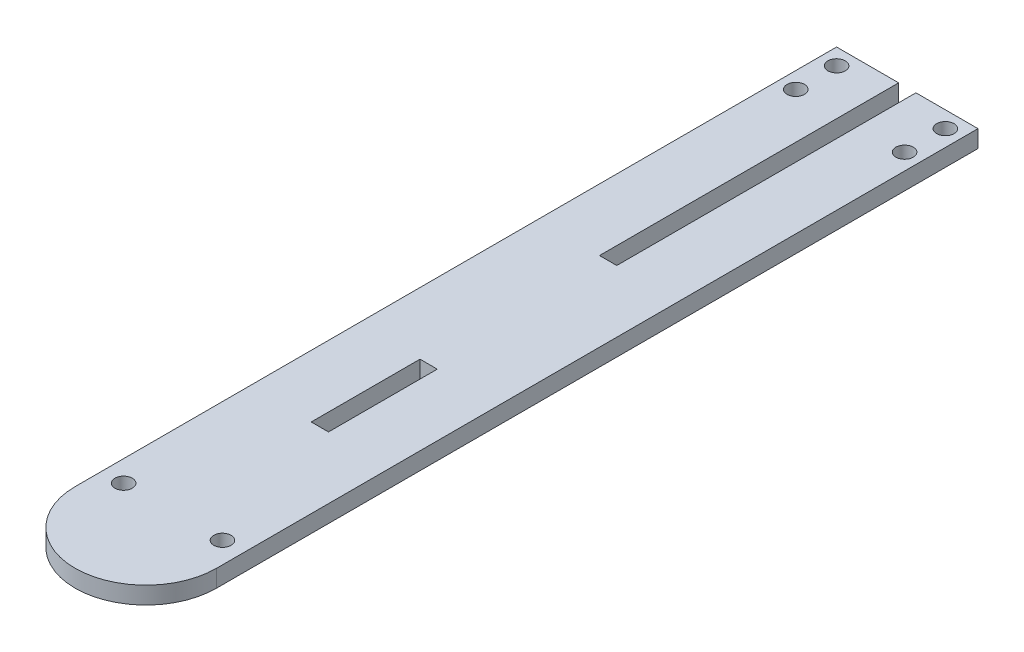
from build123d import *

# Parameters (mm, degrees)
SKETCH1_W               = 3.175
SKETCH1_H               = 20
BOSS_EXTRUDE1_DEPTH     = 3.175
CUT_EXTRUDE2_DEPTH      = 154.72662678
CUT_EXTRUDE2_DEPTH_BACK = 154.72662678
SKETCH4_R               = 1.6
CUT_EXTRUDE3_DEPTH      = 154.72662678
CUT_EXTRUDE3_DEPTH_BACK = 154.72662678
SKETCH5_R               = 1.6


with BuildPart() as part:
    # Sketch1 → Boss-Extrude1 (new body)
    with BuildSketch(Plane(origin=(0, 0, 0), x_dir=(1, 0, 0), z_dir=(0, 1, 0))):
        with BuildLine():
            Line((-14.5875, 0), (-14.5875, -140))
            ThreePointArc((-14.5875, -140), (-1.5875, -153), (11.4125, -140))
            Line((11.4125, -140), (11.4125, 0))
            Line((11.4125, 0), (0, 0))
            Line((0, 0), (0, -55))
            Line((0, -55), (-3.175, -55))
            Line((-3.175, -55), (-3.175, 0))
            Line((-3.175, 0), (-14.5875, 0))
        make_face()
        with Locations((-1.5875, -98)):
            Rectangle(SKETCH1_W, SKETCH1_H, mode=Mode.SUBTRACT)
    extrude(amount=BOSS_EXTRUDE1_DEPTH)

    # Sketch4 → Cut-Extrude2 (cut, two sides: drawn at the far end of the back side and taken through both)
    with BuildSketch(Plane.XZ.offset(-CUT_EXTRUDE2_DEPTH_BACK)):
        with Locations(Location((8.4125, 3, 0), (0, 0, 270))):
            Circle(SKETCH4_R)
        with Locations(Location((8.4125, 10.5, 0), (0, 0, 270))):
            Circle(SKETCH4_R)
        with Locations(Location((-11.5875, 10.5, 0), (0, 0, 270))):
            Circle(SKETCH4_R)
        with Locations(Location((-11.5875, 3, 0), (0, 0, 270))):
            Circle(SKETCH4_R)
    extrude(amount=CUT_EXTRUDE2_DEPTH + CUT_EXTRUDE2_DEPTH_BACK, mode=Mode.SUBTRACT)

    # Sketch5 → Cut-Extrude3 (cut, two sides: drawn at the far end of the back side and taken through both)
    with BuildSketch(Plane(origin=(0, 3.175, 0), x_dir=(1, 0, 0), z_dir=(0, 1, 0)).offset(-CUT_EXTRUDE3_DEPTH_BACK)):
        with Locations(Location((-10.675, -135, 0), (0, 0, 270))):
            Circle(SKETCH5_R)
        with Locations(Location((7.5, -135, 0), (0, 0, 270))):
            Circle(SKETCH5_R)
    extrude(amount=CUT_EXTRUDE3_DEPTH + CUT_EXTRUDE3_DEPTH_BACK, mode=Mode.SUBTRACT)


solid = part.part
